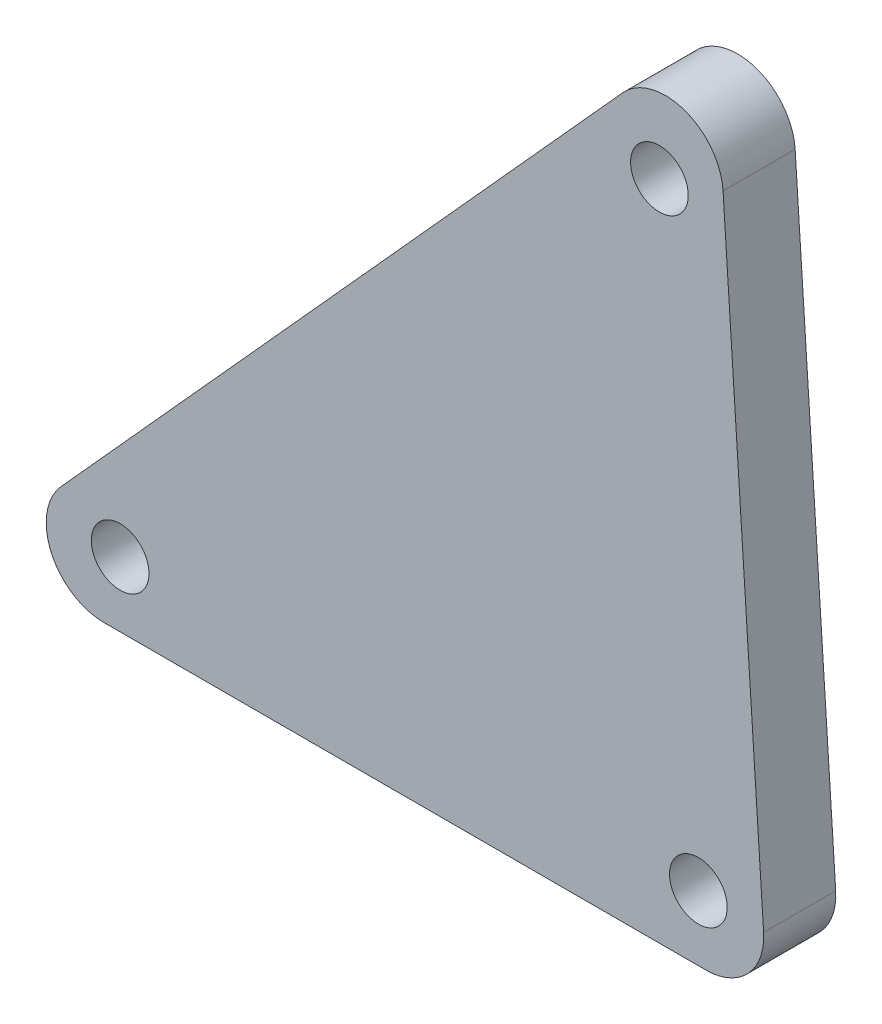
from build123d import *

# Parameters (mm, degrees)
SKETCH_2_R      = 2
EXTRUDE_1_DEPTH = 2.5


with BuildPart() as part:
    # 草圖2 → 填料-伸長1 (new, symmetric)
    with BuildSketch(Plane.XY):
        with BuildLine():
            Line((7.226190238, -41.651673377), (4.413452329, 1.473554067))
            ThreePointArc((4.413452329, 1.473554067), (1.735862232, 4.991257537), (-2.546669656, 3.894149036))
            Line((-2.546669656, 3.894149036), (-41.492870765, -39.231078407))
            ThreePointArc((-41.492870765, -39.231078407), (-42.179656235, -43.536244411), (-38.524267862, -45.912010486))
            Line((-38.524267862, -45.912010486), (3.234671155, -45.912010486))
            ThreePointArc((3.234671155, -45.912010486), (6.153690549, -44.64684609), (7.226190238, -41.651673377))
        make_face()
        Circle(SKETCH_2_R, mode=Mode.SUBTRACT)
        with Locations((2.700997506, -41.412010486)):
            Circle(SKETCH_2_R, mode=Mode.SUBTRACT)
        with Locations((-37.399002494, -41.412010486)):
            Circle(SKETCH_2_R, mode=Mode.SUBTRACT)
    extrude(amount=EXTRUDE_1_DEPTH, both=True)


solid = part.part
